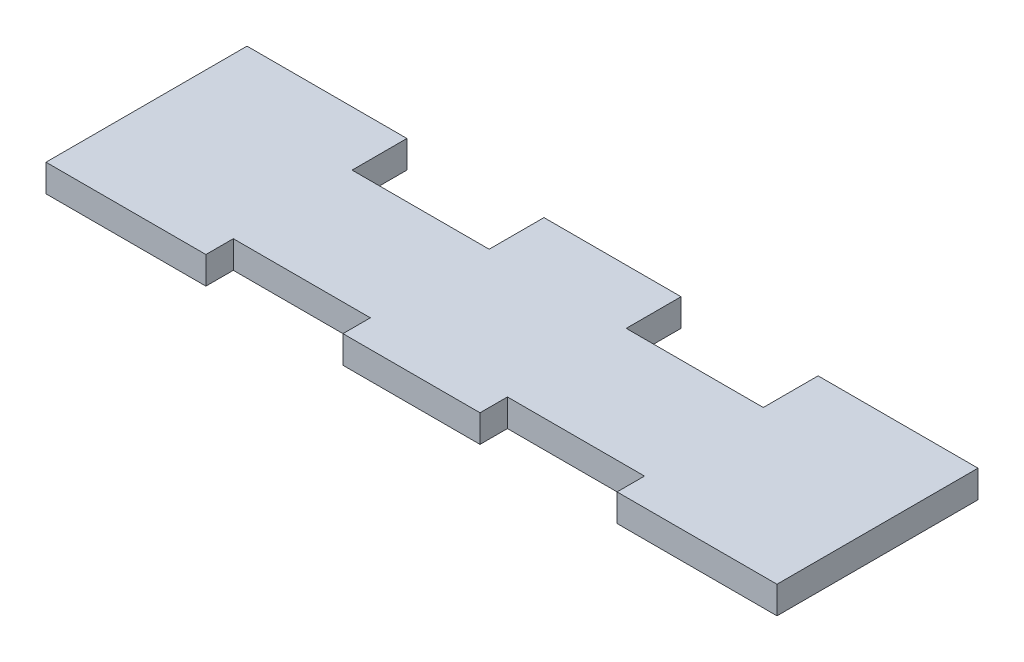
from build123d import *

# Parameters (mm, degrees)
SALIENTE_EXTRUIR1_DEPTH = 3


with BuildPart() as part:
    # Croquis1 → Saliente-Extruir1 (new body)
    with BuildSketch(Plane(origin=(0, 0, 0), x_dir=(1, 0, 0), z_dir=(0, 1, 0))):
        Polygon((0, 0), (17.5, 0), (17.5, 3), (32.5, 3), (32.5, 0), (47.5, 0), (47.5, 3), (62.5, 3), (62.5, 0), (80, 0), (80, 22), (62.5, 22), (62.5, 16), (47.5, 16), (47.5, 22), (32.5, 22), (32.5, 16), (17.5, 16), (17.5, 22), (0, 22), align=None)
    extrude(amount=SALIENTE_EXTRUIR1_DEPTH)


solid = part.part
